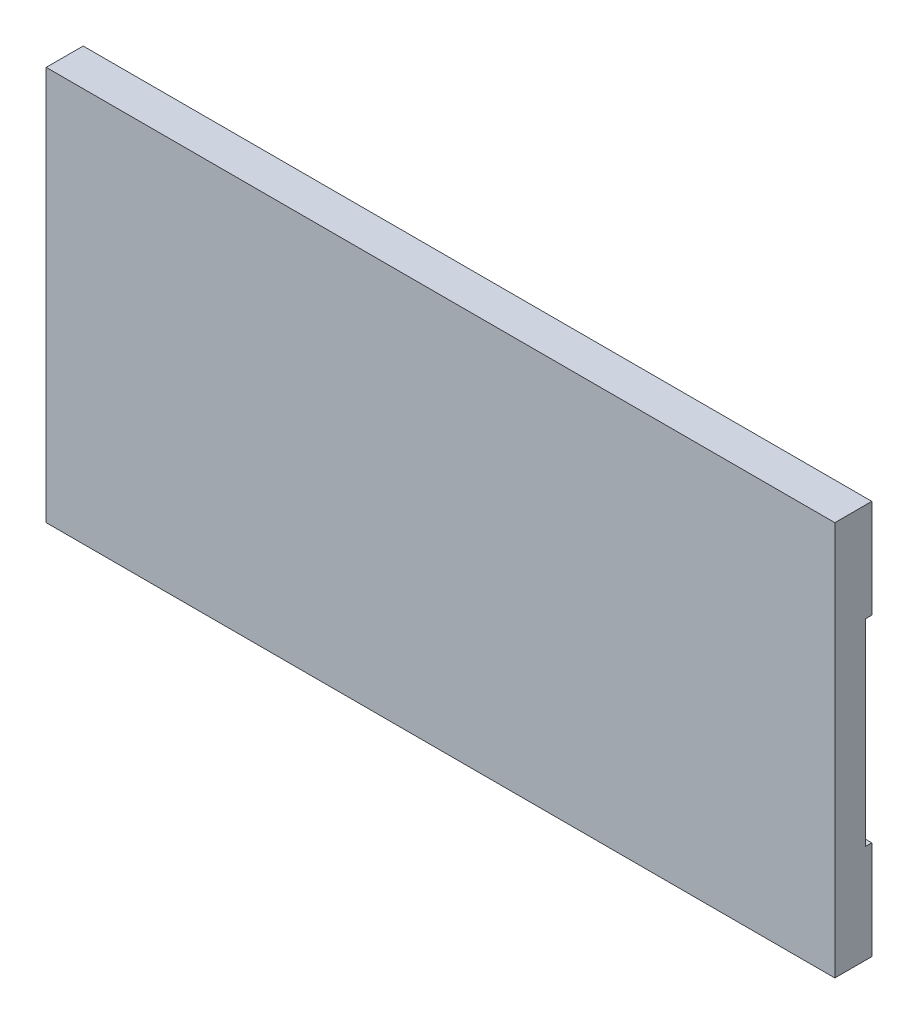
from build123d import *

# Parameters (mm, degrees)
SKETCH1_W               = 203.2
SKETCH1_H               = 101.6
BOSS_EXTRUDE1_DEPTH     = 9.525
CUT_EXTRUDE1_DEPTH      = 168.059092726
CUT_EXTRUDE1_DEPTH_BACK = 228.384092726
CUT_EXTRUDE1_START      = 60.325
SKETCH2_W               = 1.5875
SKETCH2_H               = 50.8


with BuildPart() as part:
    # Sketch1 → Boss-Extrude1 (new body)
    with BuildSketch(Plane.XY):
        with Locations((101.6, 50.8)):
            Rectangle(SKETCH1_W, SKETCH1_H)
    extrude(amount=BOSS_EXTRUDE1_DEPTH)

    # Sketch2 → Cut-Extrude1 (cut, two sides: drawn at the far end of the back side and taken through both)
    with BuildSketch(Plane(origin=(0, 0, 0), x_dir=(0, 0, -1), z_dir=(1, 0, 0)).offset(CUT_EXTRUDE1_START - CUT_EXTRUDE1_DEPTH_BACK)):
        with Locations((-0.79375, 50.8)):
            Rectangle(SKETCH2_W, SKETCH2_H)
    extrude(amount=CUT_EXTRUDE1_DEPTH + CUT_EXTRUDE1_DEPTH_BACK, mode=Mode.SUBTRACT)


solid = part.part
